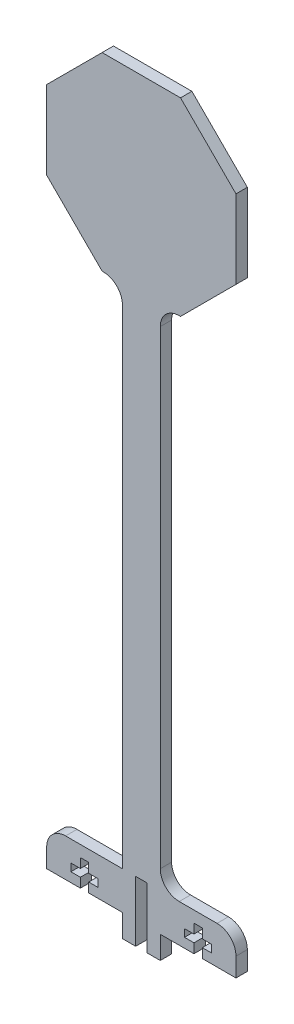
from build123d import *

# Parameters (mm, degrees)
BOSS_EXTRUDE1_DEPTH = 3
FILLET1_R           = 5


with BuildPart() as part:
    # Sketch1 → Boss-Extrude1 (new body)
    with BuildSketch(Plane.XY):
        Polygon((-5, -25), (-5, -159), (-25, -159), (-25, -169), (-16.1, -169), (-16.1, -166.5), (-18.6, -166.5), (-18.6, -164.5), (-16.1, -164.5), (-16.1, -162), (-13.9, -162), (-13.9, -164.5), (-11.4, -164.5), (-11.4, -166.5), (-13.9, -166.5), (-13.9, -169), (-5, -169), (-5, -175), (-1.5, -175), (-1.5, -159), (1.5, -159), (1.5, -175), (5, -175), (5, -169), (13.9, -169), (13.9, -166.5), (11.4, -166.5), (11.4, -164.5), (13.9, -164.5), (13.9, -162), (16.1, -162), (16.1, -164.5), (18.6, -164.5), (18.6, -166.5), (16.1, -166.5), (16.1, -169), (25, -169), (25, -159), (5, -159), (5, -25), (10.355339059, -25), (25, -10.355339059), (25, 10.355339059), (10.355339059, 25), (-10.355339059, 25), (-25, 10.355339059), (-25, -10.355339059), (-10.355339059, -25), align=None)
    extrude(amount=BOSS_EXTRUDE1_DEPTH)

    # Fillet1
    fillet1_edges = [part.edges().sort_by_distance(p)[0] for p in [
        (5, -25, 1.5),
        (5, -159, 1.5),
        (25, -159, 1.5),
        (-25, -159, 1.5),
        (-5, -25, 1.5),
    ]]
    fillet(fillet1_edges, radius=FILLET1_R)


solid = part.part
